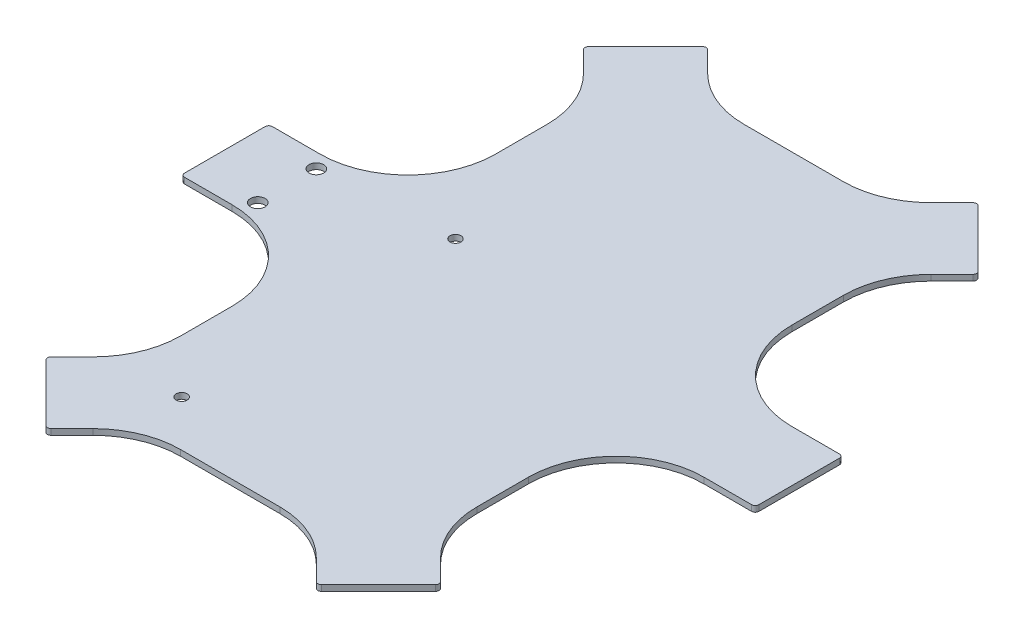
from build123d import *

# Parameters (mm, degrees)
SKETCH_8_R      = 2
SKETCH_8_R_2    = 1.5
EXTRUDE_1_DEPTH = 1.6


with BuildPart() as part:
    # 草图8 → 凸台-拉伸1 (new body)
    with BuildSketch(Plane.XZ):
        with BuildLine():
            Line((30.529437252, 84), (36.227922061, 89.69848481))
            ThreePointArc((36.227922061, 89.69848481), (36.935028843, 89.991378029), (37.642135624, 89.69848481))
            Line((37.642135624, 89.69848481), (53.19848481, 74.142135624))
            ThreePointArc((53.19848481, 74.142135624), (53.491378029, 73.435028843), (53.19848481, 72.727922061))
            Line((53.19848481, 72.727922061), (47.5, 67.029437252))
            ThreePointArc((47.5, 67.029437252), (42.297453968, 59.24327688), (40.470562748, 50.058874503))
            Line((40.470562748, 50.058874503), (40.470562748, 36))
            ThreePointArc((40.470562748, 36), (47.5, 19.029437252), (64.470562748, 12))
            Line((64.470562748, 12), (77.470562748, 12))
            ThreePointArc((77.470562748, 12), (78.17766953, 11.707106781), (78.470562748, 11))
            Line((78.470562748, 11), (78.470562748, -11))
            ThreePointArc((78.470562748, -11), (78.17766953, -11.707106781), (77.470562748, -12))
            Line((77.470562748, -12), (64.470562748, -12))
            ThreePointArc((64.470562748, -12), (47.5, -19.029437252), (40.470562748, -36))
            Line((40.470562748, -36), (40.470562748, -50.058874503))
            ThreePointArc((40.470562748, -50.058874503), (42.297453968, -59.24327688), (47.5, -67.029437252))
            Line((47.5, -67.029437252), (53.19848481, -72.727922061))
            ThreePointArc((53.19848481, -72.727922061), (53.491378029, -73.435028843), (53.19848481, -74.142135624))
            Line((53.19848481, -74.142135624), (37.642135624, -89.69848481))
            ThreePointArc((37.642135624, -89.69848481), (36.935028843, -89.991378029), (36.227922061, -89.69848481))
            Line((36.227922061, -89.69848481), (30.529437252, -84))
            ThreePointArc((30.529437252, -84), (22.74327688, -78.797453968), (13.558874503, -76.970562748))
            Line((13.558874503, -76.970562748), (-13.558874503, -76.970562748))
            ThreePointArc((-13.558874503, -76.970562748), (-22.74327688, -78.797453968), (-30.529437252, -84))
            Line((-30.529437252, -84), (-36.227922061, -89.69848481))
            ThreePointArc((-36.227922061, -89.69848481), (-36.935028843, -89.991378029), (-37.642135624, -89.69848481))
            Line((-37.642135624, -89.69848481), (-53.19848481, -74.142135624))
            ThreePointArc((-53.19848481, -74.142135624), (-53.491378029, -73.435028843), (-53.19848481, -72.727922061))
            Line((-53.19848481, -72.727922061), (-47.5, -67.029437252))
            ThreePointArc((-47.5, -67.029437252), (-42.297453968, -59.24327688), (-40.470562748, -50.058874503))
            Line((-40.470562748, -50.058874503), (-40.470562748, -36))
            ThreePointArc((-40.470562748, -36), (-47.5, -19.029437252), (-64.470562748, -12))
            Line((-64.470562748, -12), (-77.470562748, -12))
            ThreePointArc((-77.470562748, -12), (-78.17766953, -11.707106781), (-78.470562748, -11))
            Line((-78.470562748, -11), (-78.470562748, 11))
            ThreePointArc((-78.470562748, 11), (-78.17766953, 11.707106781), (-77.470562748, 12))
            Line((-77.470562748, 12), (-64.470562748, 12))
            ThreePointArc((-64.470562748, 12), (-47.5, 19.029437252), (-40.470562748, 36))
            Line((-40.470562748, 36), (-40.470562748, 50.058874503))
            ThreePointArc((-40.470562748, 50.058874503), (-42.297453968, 59.24327688), (-47.5, 67.029437252))
            Line((-47.5, 67.029437252), (-53.19848481, 72.727922061))
            ThreePointArc((-53.19848481, 72.727922061), (-53.491378029, 73.435028843), (-53.19848481, 74.142135624))
            Line((-53.19848481, 74.142135624), (-37.642135624, 89.69848481))
            ThreePointArc((-37.642135624, 89.69848481), (-36.935028843, 89.991378029), (-36.227922061, 89.69848481))
            Line((-36.227922061, 89.69848481), (-30.529437252, 84))
            ThreePointArc((-30.529437252, 84), (-22.74327688, 78.797453968), (-13.558874503, 76.970562748))
            Line((-13.558874503, 76.970562748), (13.558874503, 76.970562748))
            ThreePointArc((13.558874503, 76.970562748), (22.74327688, 78.797453968), (30.529437252, 84))
        make_face()
        with Locations(Location((-61.470562748, 8, 0), (0, 0, 90))):
            Circle(SKETCH_8_R, mode=Mode.SUBTRACT)
        with Locations(Location((-25.887975085, -10.446849588, 0), (0, 0, 90))):
            Circle(SKETCH_8_R_2, mode=Mode.SUBTRACT)
        with Locations(Location((-25.887975085, 64.387975085, 0), (0, 0, 90))):
            Circle(SKETCH_8_R_2, mode=Mode.SUBTRACT)
        with Locations(Location((-61.470562748, -8, 0), (0, 0, 90))):
            Circle(SKETCH_8_R, mode=Mode.SUBTRACT)
    extrude(amount=EXTRUDE_1_DEPTH)


solid = part.part
